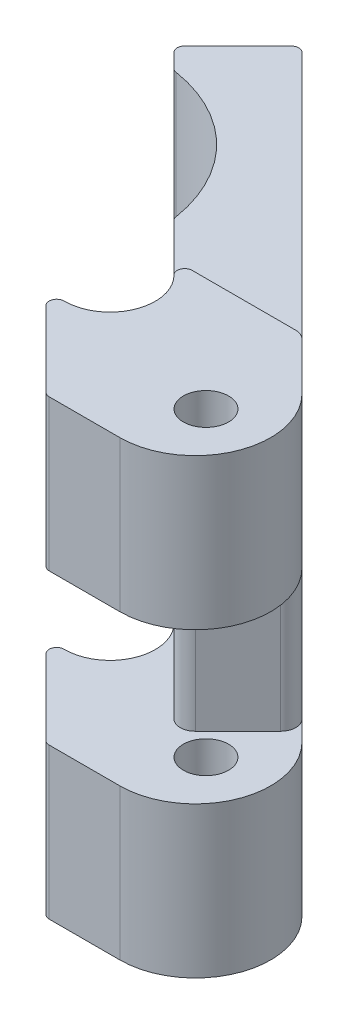
from build123d import *

# Parameters (mm, degrees)
SKETCH1_R                = 1.6
BOSS_EXTRUDE1_DEPTH      = 10
CUT_EXTRUDE1_DEPTH       = 51.495476
FILLET1_R                = 0.5
BOSS_EXTRUDE2_DEPTH      = 10
BOSS_EXTRUDE2_DEPTH_BACK = 20
SKETCH3_R                = 1.5
SKETCH4_W                = 10
SKETCH4_H                = 10
CUT_EXTRUDE3_DEPTH       = 54.383453
SKETCH5_W                = 8.66368
SKETCH5_H                = 10
CUT_EXTRUDE5_DEPTH       = 54.831153
FILLET3_R                = 0.5
FILLET4_R                = 1


with BuildPart() as part:
    # Sketch1 → Boss-Extrude1 (new body)
    with BuildSketch(Plane(origin=(0, 0, 0), x_dir=(1, 0, 0), z_dir=(0, 1, 0))):
        with BuildLine():
            Line((0, 0), (23.162951, -23.162951))
            ThreePointArc((23.162951, -23.162951), (23.813269, -26.432322), (21.041631, -28.284271))
            Line((21.041631, -28.284271), (0, -28.284271))
            Line((0, -28.284271), (0, -34.284271))
            Line((0, -34.284271), (30.698485, -34.284271))
            ThreePointArc((30.698485, -34.284271), (35.317882, -31.197688), (34.234019, -25.748737))
            Line((34.234019, -25.748737), (4.242641, 4.242641))
            Line((4.242641, 4.242641), (0, 0))
        make_face()
        with Locations(Location((31.905592, -29.784271, 0), (0, 0, 270))):
            Circle(SKETCH1_R, mode=Mode.SUBTRACT)
    extrude(amount=BOSS_EXTRUDE1_DEPTH)

    # Sketch2 → Cut-Extrude1 (cut, through all)
    with BuildSketch(Plane(origin=(0, 10, 0), x_dir=(1, 0, 0), z_dir=(0, 1, 0))):
        with BuildLine():
            Line((1.414214, -1.414214), (9.899495, -9.899495))
            ThreePointArc((9.899495, -9.899495), (7.071068, -4.242641), (1.414214, -1.414214))
        make_face()
        Polygon((0, -28.284271), (0, -34.284271), (25.79899, -34.284271), (19.79899, -28.284271), align=None)
    extrude(amount=-CUT_EXTRUDE1_DEPTH, mode=Mode.SUBTRACT)

    # Fillet1
    fillet1_edges = [part.edges().sort_by_distance(p)[0] for p in [
        (4.242641, 5, -4.242641),
        (0, 5, 0),
        (19.79899, 5, 28.284271),
        (25.79899, 5, 34.284271),
        (1.414214, 5, 1.414214),
        (9.899495, 5, 9.899495),
    ]]
    fillet(fillet1_edges, radius=FILLET1_R)

    # Sketch3 → Boss-Extrude2 (add, two sides: drawn at the far end of the back side and taken through both)
    with BuildSketch(Plane(origin=(0, 10, 0), x_dir=(1, 0, 0), z_dir=(0, 1, 0)).offset(-BOSS_EXTRUDE2_DEPTH_BACK)):
        with BuildLine():
            Line((20.652543, -29.137825), (25.652543, -34.137825))
            ThreePointArc((25.652543, -34.137825), (25.814755, -34.246211), (26.006097, -34.284271))
            Line((26.006097, -34.284271), (30.698485, -34.284271))
            ThreePointArc((30.698485, -34.284271), (35.317882, -31.197688), (34.234019, -25.748737))
            Line((34.234019, -25.748737), (31.062446, -22.577164))
            ThreePointArc((31.062446, -22.577164), (30.738022, -22.360392), (30.355339, -22.284271))
            Line((30.355339, -22.284271), (22.284271, -22.284271))
            Line((22.284271, -22.284271), (23.162951, -23.162951))
            ThreePointArc((23.162951, -23.162951), (23.813269, -26.432322), (21.041631, -28.284271))
            Line((21.041631, -28.284271), (21.006097, -28.284271))
            ThreePointArc((21.006097, -28.284271), (20.544157, -28.59293), (20.652543, -29.137825))
        make_face()
        with Locations(Location((31.905592, -29.784271, 0), (0, 0, 270))):
            Circle(SKETCH3_R, mode=Mode.SUBTRACT)
    extrude(amount=BOSS_EXTRUDE2_DEPTH + BOSS_EXTRUDE2_DEPTH_BACK)

    # Sketch4 → Cut-Extrude3 (cut, through all)
    with BuildSketch(Plane(origin=(0, 0, 0), x_dir=(0.7071067811865515, 0, 0.7071067811865437), z_dir=(-0.7071067811865437, 0, 0.7071067811865515))):
        with Locations((36.514719, 5)):
            Rectangle(SKETCH4_W, SKETCH4_H)
    extrude(amount=CUT_EXTRUDE3_DEPTH, mode=Mode.SUBTRACT)

    # Sketch5 → Cut-Extrude5 (cut, through all)
    with BuildSketch(Plane(origin=(-4.242641, 0, 4.242641), x_dir=(0.7071067811865476, 0, 0.7071067811865476), z_dir=(-0.7071067811865476, 0, 0.7071067811865476))):
        with Locations((45.846559, 5)):
            Rectangle(SKETCH5_W, SKETCH5_H)
    extrude(amount=-CUT_EXTRUDE5_DEPTH, mode=Mode.SUBTRACT)

    # Fillet3
    fillet3_edges = [part.edges().sort_by_distance(p)[0] for p in [
        (22.284271, -5, 22.284271),
        (22.284271, 15, 22.284271),
    ]]
    fillet(fillet3_edges, radius=FILLET3_R)

    # Fillet4
    fillet4_edges = [part.edges().sort_by_distance(p)[0] for p in [
        (29.355339, 5, 29.355339),
        (33.59798, 5, 25.112698),
    ]]
    fillet(fillet4_edges, radius=FILLET4_R)


solid = part.part
